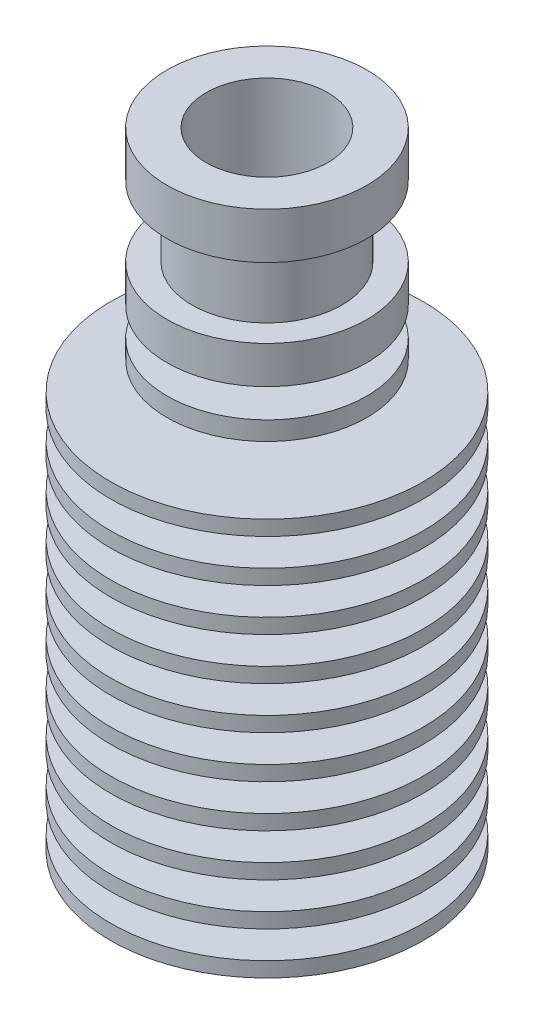
from build123d import *


with BuildPart() as part:
    # Sketch1 → Revolve1 (revolve)
    with BuildSketch(Plane.XY, mode=Mode.PRIVATE) as revolve1_sk:
        Polygon((3, -25.05), (12.5, -25.05), (12.5, -23.85), (7.5, -23.85), (7.5, -21.65), (12.5, -21.65), (12.5, -20.45), (7.5, -20.45), (7.5, -18.25), (12.5, -18.25), (12.5, -17.05), (7.5, -17.05), (7.5, -14.85), (12.5, -14.85), (12.5, -13.65), (7.5, -13.65), (7.5, -11.45), (12.5, -11.45), (12.5, -10.25), (7.5, -10.25), (7.5, -8.05), (12.5, -8.05), (12.5, -6.85), (6.5, -6.85), (6.5, -4.65), (12.5, -4.65), (12.5, -3.45), (4.5, -3.45), (4.5, -1.25), (12.5, -1.25), (12.5, -0.05), (4.5, -0.05), (4.5, 2.15), (12.5, 2.15), (12.5, 3.35), (4.5, 3.35), (4.5, 5.55), (12.5, 5.55), (12.5, 6.75), (4.5, 6.75), (4.5, 8.95), (8, 8.95), (8, 10.45), (4.5, 10.45), (4.5, 12.75), (8, 12.75), (8, 15.75), (6, 15.75), (6, 21.35), (8, 21.35), (8, 25.05), (4.8641, 25.05), (4.8641, 15.05), (2, 10.089233282), (2, 6.089233282), (1, 5.511883013), (1, -5.895299462), (3, -7.05), align=None)
    revolve(revolve1_sk.sketch.rotate(Axis((0, -25.05, 0), (0, 1, 0)), 90), axis=Axis((0, -25.05, 0), (0, 1, 0)))


solid = part.part
